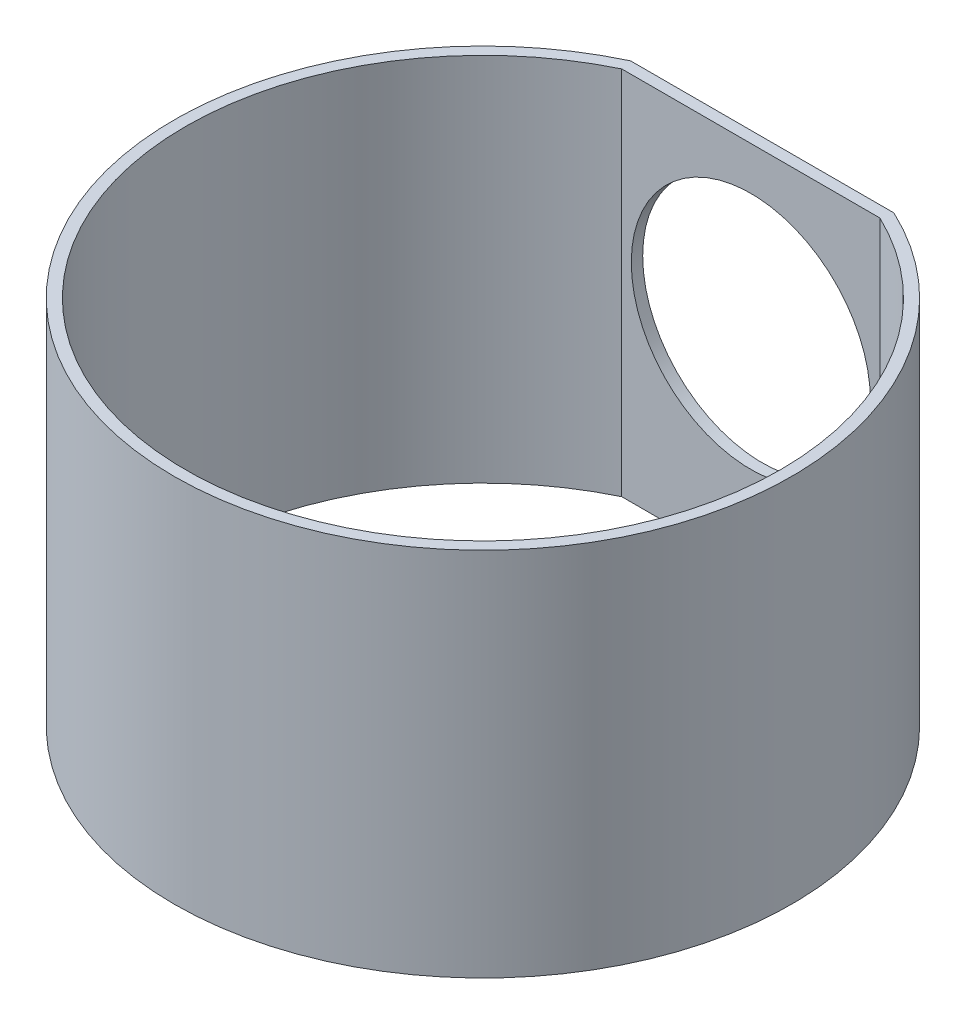
from build123d import *

# Parameters (mm, degrees)
BOSS_EXTRUDE1_DEPTH = 33
SKETCH2_R           = 10.65
CUT_EXTRUDE1_DEPTH  = 10


with BuildPart() as part:
    # Sketch1 → Boss-Extrude1 (new body)
    with BuildSketch(Plane(origin=(0, 0, 0), x_dir=(-1, 0, 0), z_dir=(0, 1, 0))):
        with BuildLine():
            Line((15.705832049, -67.814850439), (39.165320565, -67.814850439))
            ThreePointArc((39.165320565, -67.814850439), (27.435576307, -15.429277781), (15.705832049, -67.814850439))
        make_face()
        with BuildLine():
            Line((15.935576307, -66.798850439), (38.935576307, -66.798850439))
            ThreePointArc((38.935576307, -66.798850439), (27.435576307, -16.445277781), (15.935576307, -66.798850439))
        make_face(mode=Mode.SUBTRACT)
    extrude(amount=BOSS_EXTRUDE1_DEPTH)

    # Sketch2 → Cut-Extrude1 (cut)
    with BuildSketch(Plane(origin=(0, 0, -67.814850439), x_dir=(-1, 0, 0), z_dir=(0, 0, -1))):
        with Locations((27.435576307, 18.5)):
            Circle(SKETCH2_R)
    extrude(amount=-CUT_EXTRUDE1_DEPTH, mode=Mode.SUBTRACT)


solid = part.part
